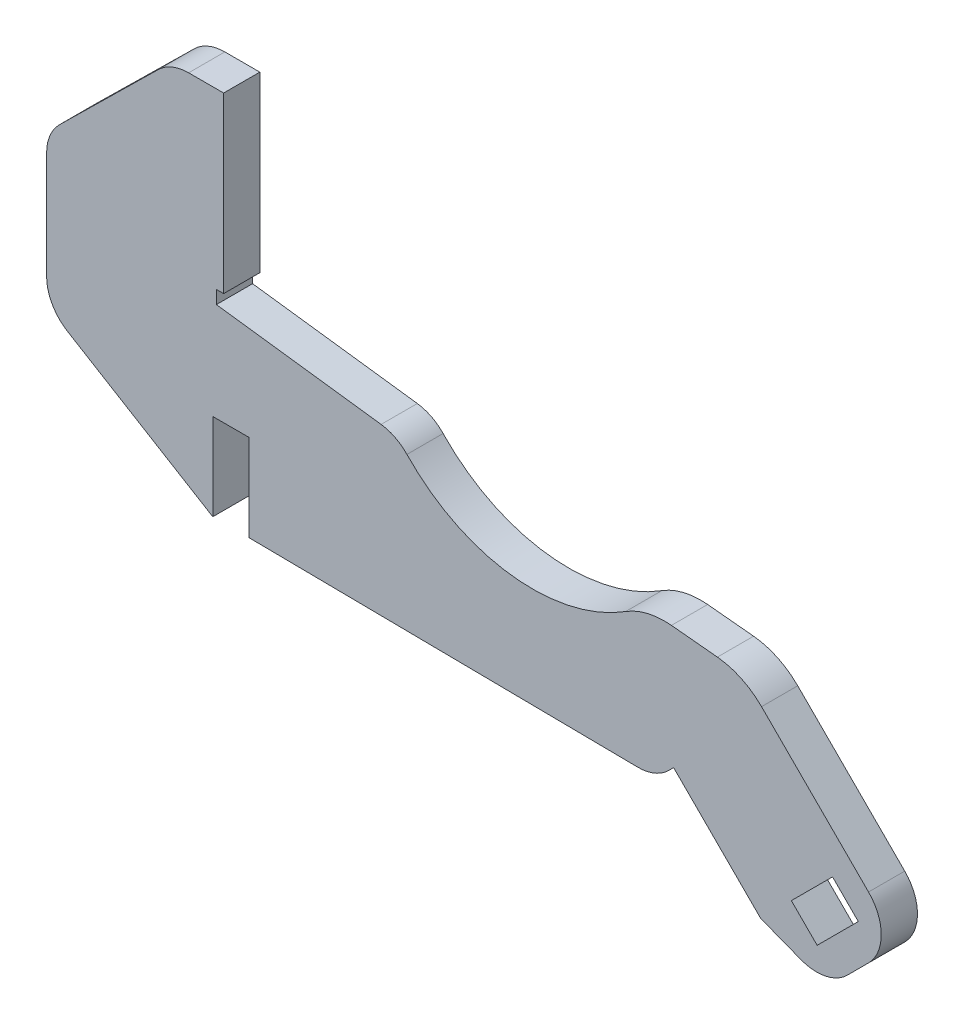
from build123d import *

# Parameters (mm, degrees)
BOSS_EXTRUDE1_DEPTH = 0.125
FILLET1_R           = 0.3
FILLET2_R           = 0.5


with BuildPart() as part:
    # frame_outline → Boss-Extrude1 (new, symmetric)
    with BuildSketch(Plane.XY):
        with BuildLine():
            Line((-0.05, -0.4), (-0.05, -1.6))
            Line((-0.05, -1.6), (-0.1, -1.6))
            Line((-0.1, -1.6), (-0.1, -1.690631342))
            Line((-0.1, -1.690631342), (1.149530794, -1.853054692))
            ThreePointArc((1.149530794, -1.853054692), (1.967232196, -2.294374324), (2.854868829, -2.019602037))
            Line((2.854868829, -2.019602037), (3.538793019, -2.08639569))
            Line((3.538793019, -2.08639569), (4.616700174, -3.164302846))
            Line((4.616700174, -3.164302846), (4.120311214, -3.660691806))
            Line((4.120311214, -3.660691806), (3.659277593, -3.482500897))
            Line((3.659277593, -3.482500897), (3.058236829, -2.881460133))
            Line((3.058236829, -2.881460133), (2.935621241, -3.004075721))
            Line((2.935621241, -3.004075721), (0.125, -2.972356033))
            Line((0.125, -2.972356033), (0.125, -2.372356033))
            Line((0.125, -2.372356033), (-0.125, -2.372356033))
            Line((-0.125, -2.372356033), (-0.125, -2.972356033))
            Line((-0.125, -2.972356033), (-1.272695348, -2.277821671))
            Line((-1.272695348, -2.277821671), (-1.272695348, -1.243831616))
            Line((-1.272695348, -1.243831616), (-0.414440871, -0.4))
            Line((-0.414440871, -0.4), (-0.05, -0.4))
        make_face()
        Polygon((3.871409627, -3.270368863), (4.049600536, -3.448559772), (4.333857462, -3.164302846), (4.155666553, -2.986111937), align=None, mode=Mode.SUBTRACT)
    extrude(amount=BOSS_EXTRUDE1_DEPTH, both=True)

    # Fillet1
    fillet1_edges = [part.edges().sort_by_distance(p)[0] for p in [
        (-1.272695348, -1.243831616, 0),
        (-0.414440871, -0.4, 0),
        (1.149530794, -1.853054692, 0),
        (4.616700174, -3.164302846, 0),
        (4.120311214, -3.660691806, 0),
        (2.935621241, -3.004075721, 0),
        (-1.272695348, -2.277821671, 0),
    ]]
    fillet(fillet1_edges, radius=FILLET1_R)

    # Fillet2
    fillet2_edges = [part.edges().sort_by_distance(p)[0] for p in [
        (2.854868829, -2.019602037, 0),
        (3.538793019, -2.08639569, 0),
    ]]
    fillet(fillet2_edges, radius=FILLET2_R)


solid = part.part
